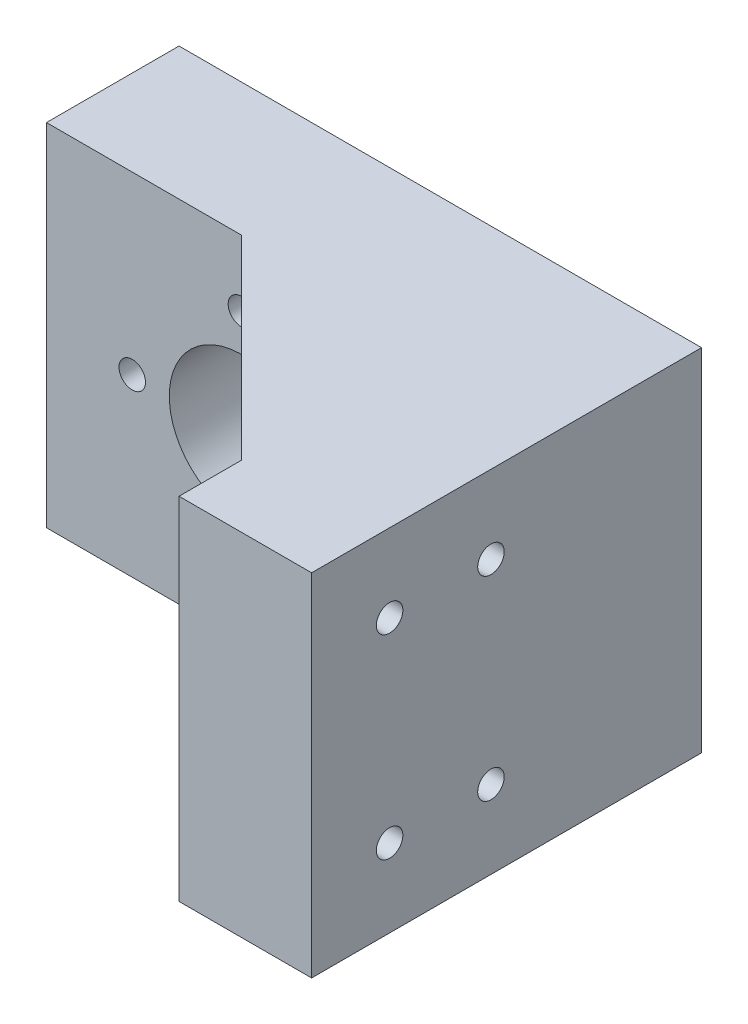
from build123d import *

# Parameters (mm, degrees)
BOSS_EXTRUDE1_DEPTH = 22.5
SKETCH2_R           = 9.25
SKETCH2_R_2         = 1.7
CUT_EXTRUDE1_DEPTH  = 53.129646076
SKETCH3_R           = 1.7
CUT_EXTRUDE2_DEPTH  = 75.204110398
BOSS_EXTRUDE4_DEPTH = 5
BOSS_EXTRUDE5_DEPTH = 5


with BuildPart() as part:
    # Sketch1 → Boss-Extrude1 (new, symmetric)
    with BuildSketch(Plane(origin=(0, 0, 0), x_dir=(-1, 0, 0), z_dir=(0, 1, 0))):
        Polygon((-33.5, 50), (-16.5, 50), (-16.5, 17), (33.5, 17), (33.5, 0), (-33.5, 0), align=None)
    extrude(amount=BOSS_EXTRUDE1_DEPTH, both=True)

    # Sketch2 → Cut-Extrude1 (cut, through all)
    with BuildSketch(Plane.XY.offset(17)):
        with Locations((-8.5, 0)):
            Circle(SKETCH2_R)
        with Locations((-8.5, 14)):
            Circle(SKETCH2_R_2)
        with Locations((5.5, 0)):
            Circle(SKETCH2_R_2)
        with Locations((-8.5, -14)):
            Circle(SKETCH2_R_2)
        with Locations((-22.5, 0)):
            Circle(SKETCH2_R_2)
    extrude(amount=-CUT_EXTRUDE1_DEPTH, mode=Mode.SUBTRACT)

    # Sketch3 → Cut-Extrude2 (cut, through all)
    with BuildSketch(Plane(origin=(16.5, 0, 0), x_dir=(0, -1, 0), z_dir=(-1, 0, 0))):
        with Locations(Location((12.5, 40, 0), (0, 0, 90))):
            Circle(SKETCH3_R)
        with Locations(Location((-12.5, 40, 0), (0, 0, 90))):
            Circle(SKETCH3_R)
        with Locations(Location((12.5, 27, 0), (0, 0, 270))):
            Circle(SKETCH3_R)
        with Locations(Location((-12.5, 27, 0), (0, 0, 270))):
            Circle(SKETCH3_R)
    extrude(amount=-CUT_EXTRUDE2_DEPTH, mode=Mode.SUBTRACT)

    # Sketch8 → Boss-Extrude4 (add)
    with BuildSketch(Plane(origin=(0, 22.5, 0), x_dir=(-1, 0, 0), z_dir=(0, 1, 0))):
        Polygon((-16.5, 42), (8.5, 17), (-16.5, 17), align=None)
    extrude(amount=-BOSS_EXTRUDE4_DEPTH)

    # Sketch9 → Boss-Extrude5 (add)
    with BuildSketch(Plane.XZ.offset(22.5)):
        Polygon((-8.5, 17), (16.5, 17), (16.5, 42), align=None)
    extrude(amount=-BOSS_EXTRUDE5_DEPTH)


solid = part.part
